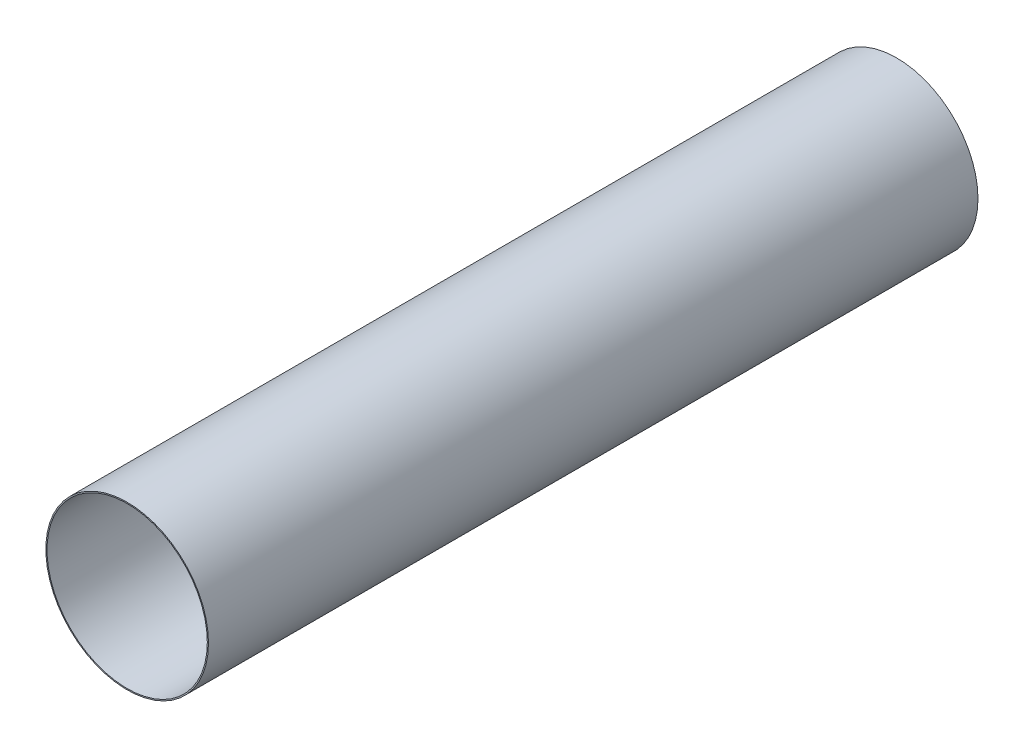
from build123d import *

# Parameters (mm, degrees)
SKETCH1_R           = 80.518
SKETCH1_R_2         = 79.375
BOSS_EXTRUDE1_DEPTH = 762


with BuildPart() as part:
    # Sketch1 → Boss-Extrude1 (new body)
    with BuildSketch(Plane.XY):
        Circle(SKETCH1_R)
        Circle(SKETCH1_R_2, mode=Mode.SUBTRACT)
    extrude(amount=BOSS_EXTRUDE1_DEPTH)


solid = part.part
